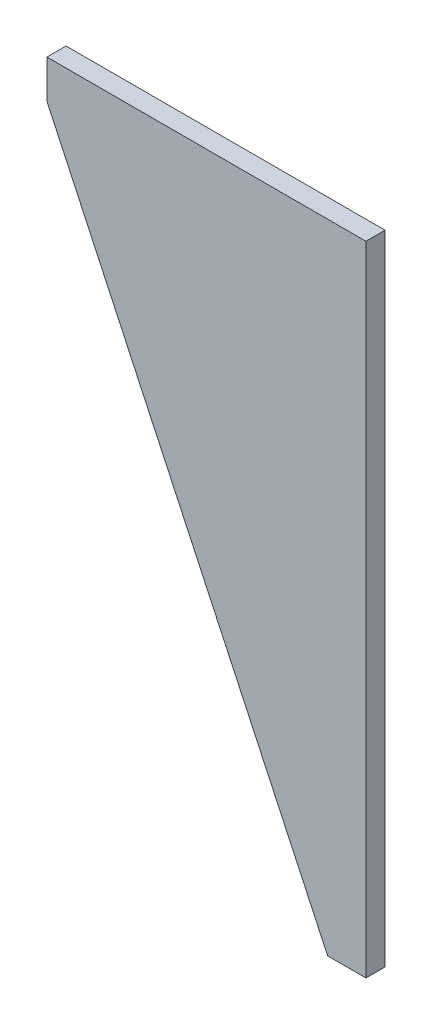
from build123d import *

# Parameters (mm, degrees)
EXTRUDE_1_DEPTH = 3


with BuildPart() as part:
    # Эскиз1 → Бобышка-Вытянуть1 (new body)
    with BuildSketch(Plane.XY):
        Polygon((0, -94), (-6, -94), (-50, 0), (-50, 6), (0, 6), align=None)
    extrude(amount=EXTRUDE_1_DEPTH)


solid = part.part
